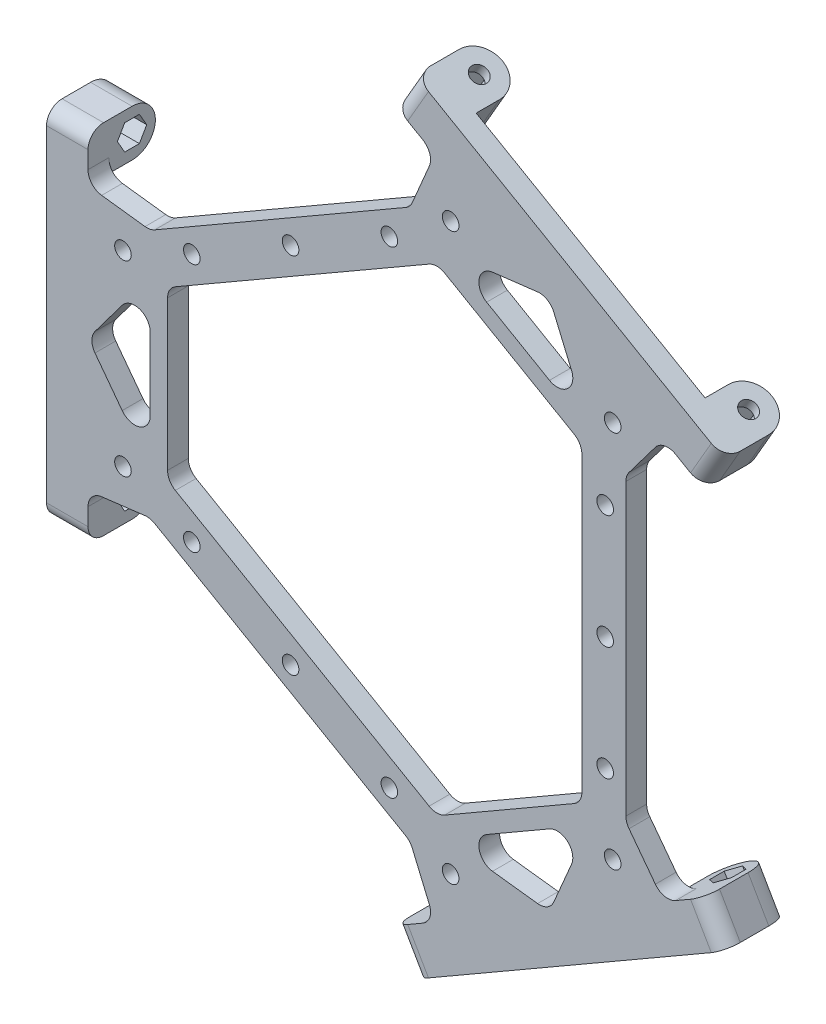
from build123d import *

# Parameters (mm, degrees)
SKETCH_1_R               = 1.5999999999999954
SKETCH_1_R_2             = 1.5999999999999985
SKETCH_1_R_3             = 1.5999999999999959
SKETCH_1_R_4             = 1.600000000000005
SKETCH_1_R_5             = 1.6000000000000005
SKETCH_1_R_6             = 1.5999999999999976
SKETCH_1_R_7             = 1.599999999999998
SKETCH_1_R_8             = 1.6000000000000023
SKETCH_1_R_9             = 1.6000000000000012
SKETCH_1_R_10            = 1.5999999999999979
SKETCH_1_W               = 8
SKETCH_1_H               = 8.99999999999999
EXTRUDE_1_DEPTH          = 4
SKETCH_2_R               = 4.500000000000003
SKETCH_2_R_2             = 1.6
SKETCH_2_R_3             = 4.500000000000001
SKETCH_2_R_4             = 1.599999999999998
EXTRUDE_3_DEPTH          = 8
PATTERN_CIRCULAR_1_COUNT = 3
FILLET_2_R               = 3
CUT_EXTRUDE_2_DEPTH      = 6
PATTERN_CIRCULAR_3_COUNT = 3


with BuildPart() as part:
    # 草图1 → 凸台-拉伸1 (new body)
    # profile 1 of 16: a face of its own
    with BuildSketch(Plane.XY):
        Polygon((44.464500340630636, -28.960036171369484), (44.464500340630636, 28.960036171369484), (37.512595055169946, 32.973720559311005), (9.799782134067897, 48.973720559311005), (2.8478768486072568, 52.98740494725249), (-47.312377189237296, 24.027368775883648), (-47.3123771892376, 16), (-47.3123771892376, -16), (-47.31237718923761, -24.027368775883005), (2.8478768486066355, -52.98740494725272), (9.79978213406735, -48.97372055931129), (37.51259505516939, -32.973720559311296), align=None)
        with Locations((-20.232250170315503, -35.04328524643012)):
            Circle(SKETCH_1_R, mode=Mode.SUBTRACT)
        with Locations((-39.284809053573106, -24.04328524643045)):
            Circle(SKETCH_1_R_2, mode=Mode.SUBTRACT)
        with Locations((-1.1796912870577958, -46.04328524643045)):
            Circle(SKETCH_1_R_3, mode=Mode.SUBTRACT)
        with Locations((40.46450034063091, -22)):
            Circle(SKETCH_1_R_2, mode=Mode.SUBTRACT)
        with Locations((-39.28480905357312, 24.04328524643042)):
            Circle(SKETCH_1_R_4, mode=Mode.SUBTRACT)
        with Locations((-20.23225017031499, 35.0432852464304)):
            Circle(SKETCH_1_R_5, mode=Mode.SUBTRACT)
        Polygon((-43.96301228384862, -16.146170929400462), (-43.96301228384863, 16.146170929400462), (7.998511943217707, 46.14617092940049), (35.964500340630906, 30.000000000000014), (35.96450034063091, -29.999999999999986), (7.998511943217715, -46.146170929400455), align=None, mode=Mode.SUBTRACT)
        with Locations((-1.1796912870578313, 46.043285246430436)):
            Circle(SKETCH_1_R_6, mode=Mode.SUBTRACT)
        with Locations((40.46450034063065, -2.51e-15)):
            Circle(SKETCH_1_R_7, mode=Mode.SUBTRACT)
        with Locations((40.46450034063091, 22)):
            Circle(SKETCH_1_R_2, mode=Mode.SUBTRACT)
    # profile 2 of 16: a face of its own
    with BuildSketch(Plane.XY):
        Polygon((44.464500340630636, 28.960036171369484), (51.73983639112214, 38.61602540472416), (29.65618859461901, 51.36602540472426), (37.51259505516994, 32.973720559310955), align=None)
        with Locations((41.9119414573734, 36.49999999999926)):
            Circle(SKETCH_1_R_8, mode=Mode.SUBTRACT)
    # profile 3 of 16: a face of its own
    with BuildSketch(Plane.XY):
        Polygon((29.65618859461901, 51.36602540472426), (7.572540798115881, 64.11602540472437), (2.847876848607382, 52.98740494725267), (9.799782134067897, 48.973720559311005), align=None)
        with Locations((10.653956509445148, 54.54680602401111)):
            Circle(SKETCH_1_R_9, mode=Mode.SUBTRACT)
    # profile 4 of 16: a face of its own
    with BuildSketch(Plane.XY):
        Polygon((29.656188594618296, -51.36602540472467), (51.7398363911216, -38.61602540472487), (44.46450034063025, -28.960036171370128), (37.51259505516939, -32.973720559311296), align=None)
        with Locations((41.9119414573729, -36.49999999999984)):
            Circle(SKETCH_1_R_3, mode=Mode.SUBTRACT)
    # profile 5 of 16: a face of its own
    with BuildSketch(Plane.XY):
        Polygon((2.8478768486066355, -52.98740494725272), (7.572540798114993, -64.11602540472445), (29.656188594618296, -51.36602540472467), (9.799782134067298, -48.973720559311204), align=None)
        with Locations((10.653956509444395, -54.54680602401124)):
            Circle(SKETCH_1_R_10, mode=Mode.SUBTRACT)
    # profile 6 of 16: a face of its own
    with BuildSketch(Plane.XY):
        Polygon((11.5725407981151, -71.0442286350003), (55.73983639112147, -45.54422863500031), (51.7398363911216, -38.61602540472487), (29.656188594618296, -51.36602540472467), (7.572540798114994, -64.11602540472445), align=None)
    # profile 7 of 16: a face of its own
    with BuildSketch(Plane.XY):
        Polygon((51.73983639112214, 38.61602540472416), (55.73983639112217, 45.54422863499965), (11.57254079811591, 71.04422863499988), (7.572540798115882, 64.11602540472437), (29.65618859461901, 51.36602540472426), align=None)
    # profile 8 of 16: a face of its own
    with BuildSketch(Plane.XY):
        Polygon((59.53406502518206, 34.11602540472412), (63.53406502518211, 41.04422863499961), (55.73983639112228, 45.54422863499985), (51.73983639112214, 38.61602540472416), align=None)
    # profile 9 of 16: a face of its own
    with BuildSketch(Plane.XY):
        Polygon((7.572540798115882, 64.11602540472437), (11.572540798115917, 71.04422863499985), (3.7783121640559614, 75.54422863499988), (-0.2216878359440484, 68.61602540472441), align=None)
    # profile 10 of 16: a face of its own
    with BuildSketch(Plane.XY):
        Polygon((3.7783121640551514, -75.5442286350003), (11.5725407981151, -71.0442286350003), (7.572540798114994, -64.11602540472445), (-0.22168783594499544, -68.61602540472438), align=None)
    # profile 11 of 16: a face of its own
    with BuildSketch(Plane.XY):
        Polygon((55.73983639112147, -45.54422863500031), (63.53406502518142, -41.04422863500031), (59.534065025181576, -34.116025404724944), (51.7398363911216, -38.61602540472487), align=None)
    # profile 12 of 16: a face of its own
    with BuildSketch(Plane.XY):
        Polygon((-47.3123771892376, 16), (-47.312377189237594, 24.027368775883645), (-59.31237718923755, 25.5), (-59.31237718923755, 0), align=None)
        with Locations((-52.56589796681814, 18.046806024011694)):
            Circle(SKETCH_1_R_2, mode=Mode.SUBTRACT)
    # profile 13 of 16: a face of its own
    with BuildSketch(Plane.XY):
        Polygon((-59.31237718923755, -25.5), (-47.31237718923766, -24.027368775883), (-47.3123771892376, -16), (-59.312377189237544, 0), align=None)
        with Locations((-52.56589796681814, -18.046806024011694)):
            Circle(SKETCH_1_R_2, mode=Mode.SUBTRACT)
    # profile 14 of 16: a face of its own
    with BuildSketch(Plane.XY):
        Polygon((-59.31237718923755, 0), (-59.31237718923755, 25.5), (-67.31237718923755, 25.5), (-67.31237718923768, -25.499999999999986), (-59.31237718923755, -25.5), align=None)
    # profile 15 of 16: a face of its own
    with BuildSketch(Plane.XY):
        Polygon((-59.312377189237544, -34.49999999999999), (-59.31237718923755, -25.5), (-67.31237718923755, -25.5), (-67.31237718923768, -34.499999999999986), align=None)
    # profile 16 of 16: a face of its own
    with BuildSketch(Plane.XY):
        with Locations((-63.31237718923755, 30)):
            Rectangle(SKETCH_1_W, SKETCH_1_H)
    extrude(amount=EXTRUDE_1_DEPTH)

    # 草图2 → 凸台-拉伸3 (add)
    # profile 1 of 6: a face of its own
    with BuildSketch(Plane(origin=(-67.31237718923755, -2e-17, 0), x_dir=(0, 0, -1), z_dir=(1, 0, 0))):
        with Locations((4.500000000000001, 30)):
            Circle(SKETCH_2_R)
        with Locations((4.500000000000001, 30)):
            Circle(SKETCH_2_R_2, mode=Mode.SUBTRACT)
    # profile 2 of 6: a face of its own
    with BuildSketch(Plane(origin=(-67.31237718923755, -2e-17, 0), x_dir=(0, 0, -1), z_dir=(1, 0, 0))):
        with BuildLine():
            ThreePointArc((4.5, 25.499999999999996), (1.3180194885719345, 26.818019480749136), (-1.78e-15, 29.99999998893689))
            Line((0, 29.99999998893689), (0, 25.500000000000004))
            Line((0, 25.500000000000004), (4.500000000000002, 25.5))
        make_face()
    # profile 3 of 6: a face of its own
    with BuildSketch(Plane(origin=(-67.31237718923755, -2e-17, 0), x_dir=(0, 0, -1), z_dir=(1, 0, 0))):
        with BuildLine():
            Line((4.5, 34.49999999999999), (0, 34.49999999999999))
            Line((0, 34.49999999999999), (0, 29.99999998893689))
            ThreePointArc((-1.78e-15, 29.99999998893689), (1.3180194807491352, 33.181980511428065), (4.5, 34.5))
        make_face()
    # profile 4 of 6: a face of its own
    with BuildSketch(Plane(origin=(-67.31237718923755, -2e-17, 0), x_dir=(0, 0, -1), z_dir=(1, 0, 0))):
        with BuildLine():
            ThreePointArc((4.499999999999991, -34.5), (1.3180194846605295, -33.18198051533946), (-5.33e-15, -30))
            Line((-5.71e-15, -30), (-6.57e-15, -34.49999999999999))
            Line((-6.22e-15, -34.49999999999999), (4.499999999999993, -34.49999999999999))
        make_face()
    # profile 5 of 6: a face of its own
    with BuildSketch(Plane(origin=(-67.31237718923755, -2e-17, 0), x_dir=(0, 0, -1), z_dir=(1, 0, 0))):
        with Locations((4.499999999999996, -30)):
            Circle(SKETCH_2_R_3)
        with Locations((4.499999999999996, -30)):
            Circle(SKETCH_2_R_4, mode=Mode.SUBTRACT)
    # profile 6 of 6: a face of its own
    with BuildSketch(Plane(origin=(-67.31237718923755, -2e-17, 0), x_dir=(0, 0, -1), z_dir=(1, 0, 0))):
        with BuildLine():
            Line((4.4999999999999964, -25.499999999999993), (-4.44e-15, -25.500000000000004))
            Line((-4.86e-15, -25.500000000000004), (-5.71e-15, -30))
            ThreePointArc((-5.33e-15, -30), (1.3180194846605313, -26.818019484660535), (4.4999999999999964, -25.5))
        make_face()
    extrude_3 = extrude(amount=EXTRUDE_3_DEPTH)

    # 阵列(圆周)1: 凸台-拉伸3 ×3 about axis
    pattern_circular_1_axis = Axis((7.46e-15, 5.6e-15, 0), (0, 0, 1))
    for i in range(1, PATTERN_CIRCULAR_1_COUNT):
        add(extrude_3.rotate(pattern_circular_1_axis, i * 360 / PATTERN_CIRCULAR_1_COUNT))

    # 圆角2
    fillet_2_edges = [part.edges().sort_by_distance(p)[0] for p in [
        (2.847876848606658, -52.987404947252756, 2),
        (-47.31237718923764, -24.027368775883005, 2),
        (-59.31237718923755, -25.5, 2),
        (-63.31237718923755, 34.49999999999999, 4),
        (-63.31237718923755, -34.49999999999999, 4),
        (1.778312164054975, -72.08012701986216, 4),
        (61.53406502518155, -37.580127019862715, 4),
        (61.53406502518209, 37.58012701986186, 4),
        (9.799782134067936, 48.97372055931105, 2),
        (37.51259505516994, 32.973720559310976, 2),
        (29.65618859461901, 51.366025404724255, 2),
        (-43.96301228384863, 16.146170929400462, 2),
        (1.7783121640559707, 72.08012701986215, 4),
        (-43.96301228384862, -16.146170929400462, 2),
        (7.998511943217715, -46.146170929400455, 2),
        (35.96450034063091, -29.999999999999986, 2),
        (35.964500340630906, 30.000000000000014, 2),
        (7.998511943217705, 46.14617092940049, 2),
        (37.51259505516944, -32.97372055931139, 2),
        (9.799782134067325, -48.973720559311246, 2),
        (29.656188594618293, -51.36602540472467, 2),
        (-47.31237718923757, -16, 2),
        (-47.31237718923757, 16, 2),
        (-59.31237718923755, 0, 2),
        (-59.31237718923755, 25.5, 2),
        (-47.312377189237445, 24.027368775883645, 2),
        (2.8478768486073207, 52.987404947252585, 2),
        (7.572540798115881, 64.11602540472437, 2),
        (51.73983639112214, 38.61602540472416, 2),
        (44.464500340630636, 28.960036171369488, 2),
        (44.464500340630494, -28.96003617136956, 2),
        (51.7398363911216, -38.61602540472487, 2),
        (7.572540798114993, -64.11602540472445, 2),
    ]]
    fillet(fillet_2_edges, radius=FILLET_2_R)

    # 草图4 → 切除-拉伸2 (cut)
    with BuildSketch(Plane(origin=(-59.31237718923757, -4.573e-14, 0), x_dir=(0, 0, -1), z_dir=(1, 7.7e-16, 0))):
        Polygon((7.329016319029161, -29.99999999999995), (5.914508159514576, -27.549999999999955), (3.085491840485408, -27.549999999999955), (1.6709836809708258, -29.99999999999995), (3.0854918404854095, -32.44999999999995), (5.914508159514577, -32.44999999999995), align=None)
        Polygon((5.914508159514577, 32.44999999999995), (7.329016319029161, 29.99999999999995), (5.914508159514576, 27.549999999999955), (3.085491840485408, 27.549999999999955), (1.6709836809708258, 29.99999999999995), (3.0854918404854095, 32.44999999999995), align=None)
    cut_extrude_2 = extrude(amount=-CUT_EXTRUDE_2_DEPTH, mode=Mode.SUBTRACT)

    # 阵列(圆周)3: 切除-拉伸2 ×3 about axis
    pattern_circular_3_axis = Axis((1.5e-16, 3.39e-15, 0), (0, 0, 1))
    for i in range(1, PATTERN_CIRCULAR_3_COUNT):
        add(cut_extrude_2.rotate(pattern_circular_3_axis, i * 360 / PATTERN_CIRCULAR_3_COUNT), mode=Mode.SUBTRACT)


solid = part.part
